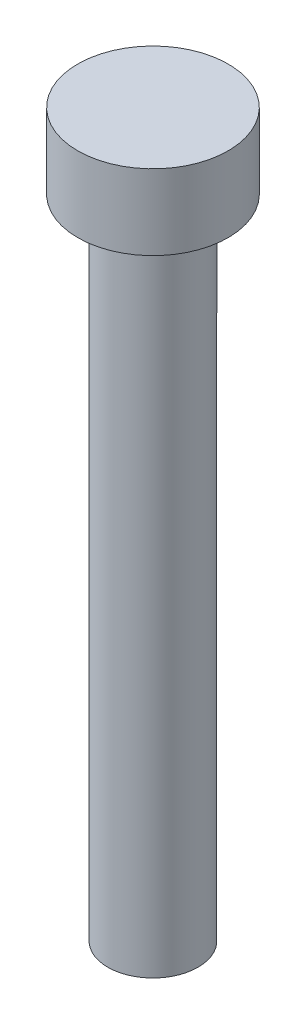
from build123d import *

# Parameters (mm, degrees)
BOSS_EXTRUDE1_DEPTH      = 29.718
BOSS_EXTRUDE1_DEPTH_BACK = 8.89
SKETCH2_R                = 3.048
SKETCH3_R                = 5.08
BOSS_EXTRUDE2_DEPTH      = 5.08
SKETCH4_R                = 3.048
BOSS_EXTRUDE3_DEPTH      = 5.08


with BuildPart() as part:
    # Sketch2 → Boss-Extrude1 (new, two sides: drawn at the far end of the back side and taken through both)
    with BuildSketch(Plane(origin=(0, 0, 0), x_dir=(1, 0, 0), z_dir=(0, 1, 0)).offset(-BOSS_EXTRUDE1_DEPTH_BACK)):
        with Locations(Location((0, 0, 0), (0, 0, 270))):
            Circle(SKETCH2_R)
    extrude(amount=BOSS_EXTRUDE1_DEPTH + BOSS_EXTRUDE1_DEPTH_BACK)

    # Sketch3 → Boss-Extrude2 (add)
    with BuildSketch(Plane(origin=(0, 29.718, 0), x_dir=(1, 0, 0), z_dir=(0, 1, 0))):
        with Locations(Location((0, 0, 0), (0, 0, 270))):
            Circle(SKETCH3_R)
    extrude(amount=BOSS_EXTRUDE2_DEPTH)

    # Sketch4 → Boss-Extrude3 (add)
    with BuildSketch(Plane.XZ.offset(8.89)):
        with Locations(Location((0, 0, 0), (0, 0, 90))):
            Circle(SKETCH4_R)
    extrude(amount=BOSS_EXTRUDE3_DEPTH)


solid = part.part
